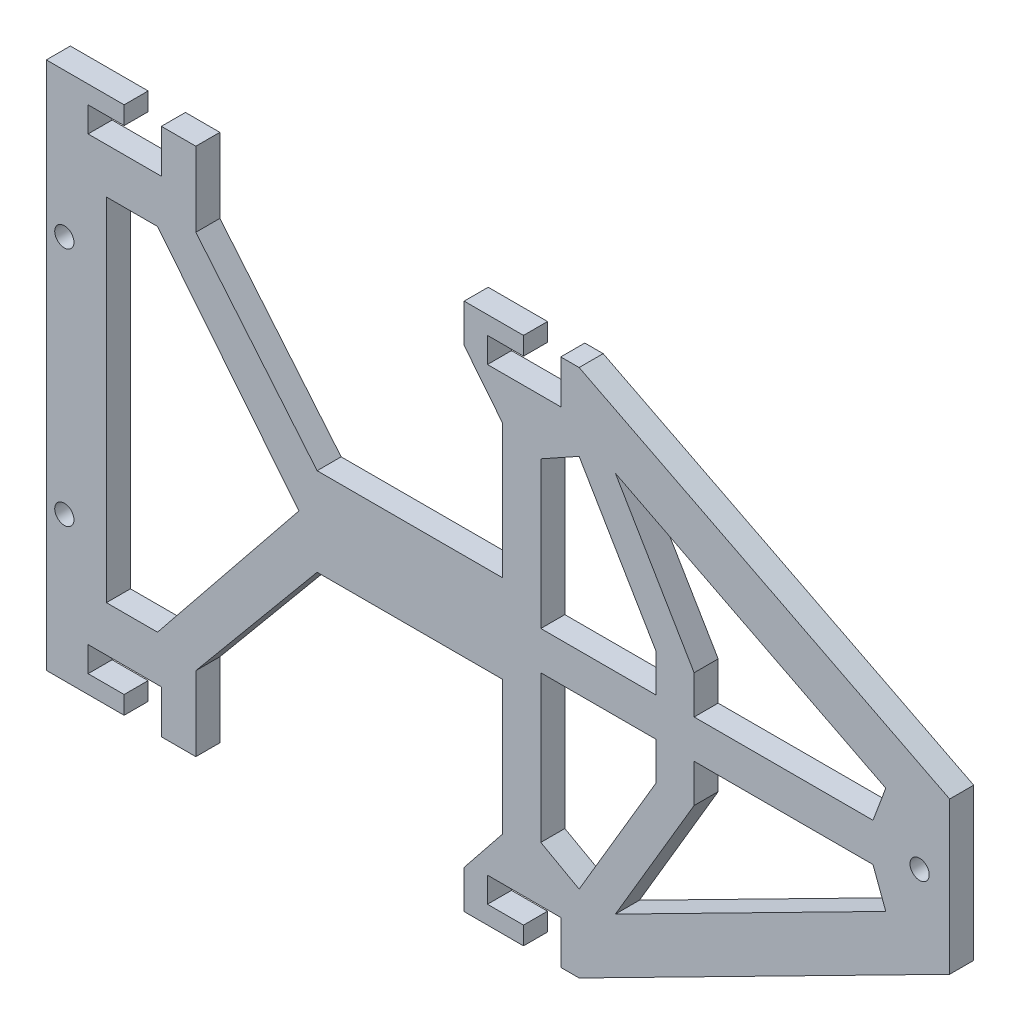
from build123d import *

# Parameters (mm, degrees)
EXTRUDE_2_DEPTH        = 2
HOLE_WIZARD_M2_1_D     = 1.6
HOLE_WIZARD_M2_1_DEPTH = 5.2
HOLE_WIZARD_M2_1_TIP   = 0.480688495


with BuildPart() as part:
    # 草图2 → 凸台-拉伸2 (new body)
    with BuildSketch(Plane.XY):
        Polygon((-26.050632556, -22), (-26.050632556, -15.796671569), (-15.95719104, -3.658227581), (-0.531644656, -3.658227581), (-0.531644656, -14.822784766), (-3.721518143, -18.810126501), (-3.721518143, -22), (1.218768965, -22), (1.218768965, -20.5), (-1.781231035, -20.5), (-1.781231035, -18.4), (4.318768965, -18.4), (4.318768965, -22), (5.848102303, -22), (36.683545842, -6.316455894), (36.683545842, 0), (36.683545842, 6.316455398), (5.848102306, 22), (4.318768965, 22), (4.318768965, 18.4), (-1.781231035, 18.4), (-1.781231035, 20.5), (1.218768965, 20.5), (1.218768965, 22), (-3.721518139, 22), (-3.721518139, 18.810127986), (-0.531644652, 14.822786003), (-0.531644652, 3.65822808), (-15.95719104, 3.65822808), (-26.050632552, 15.796672063), (-26.050632552, 22), (-28.918052143, 22), (-28.918052143, 18.4), (-35.018052143, 18.4), (-35.018052143, 20.5), (-32.018052143, 20.5), (-32.018052143, 22), (-38.494101839, 22), (-38.494101839, -22), (-32.018052143, -22), (-32.018052143, -20.5), (-35.018052143, -20.5), (-35.018052143, -18.4), (-28.918052143, -18.4), (-28.918052143, -22), align=None)
        Polygon((31.367089202, 4.441746568), (30.303797872, 1.594936736), (15.417722268, 1.594936736), (15.417722268, 4.784810719), (8.86606295, 15.886233204), align=None, mode=Mode.SUBTRACT)
        Polygon((30.303797878, -1.594936257), (31.367089202, -4.441745082), (8.86606295, -15.886233452), (15.417722268, -4.784810223), (15.417722268, -1.594936257), align=None, mode=Mode.SUBTRACT)
        Polygon((5.8481023, -15.594936496), (2.658228824, -13.822784785), (2.658228824, -1.594936252), (12.227849285, -1.594936252), (12.227849285, -4.784810209), align=None, mode=Mode.SUBTRACT)
        Polygon((12.22784928, 1.594936739), (2.658228819, 1.594936739), (2.658228819, 13.822786023), (5.848102294, 15.594936248), (12.22784928, 4.784810704), align=None, mode=Mode.SUBTRACT)
        Polygon((-17.475034956, -1.79e-07), (-29.240506549, -14.620253036), (-33.493669867, -14.620253036), (-33.493669867, 14.620254005), (-29.240506547, 14.620254005), align=None, mode=Mode.SUBTRACT)
    extrude(amount=EXTRUDE_2_DEPTH)

    # M2 螺纹孔1
    with Locations(Plane.XY.offset(2)):
        with Locations((-36.994101839, 10), (-36.994101839, -10), (34.183545842, 0)):
            Hole(HOLE_WIZARD_M2_1_D / 2, depth=HOLE_WIZARD_M2_1_DEPTH)
            with Locations((0, 0, -(HOLE_WIZARD_M2_1_DEPTH + HOLE_WIZARD_M2_1_TIP / 2))):  # 118° drill point
                Cone(0, HOLE_WIZARD_M2_1_D / 2, HOLE_WIZARD_M2_1_TIP, mode=Mode.SUBTRACT)


solid = part.part
